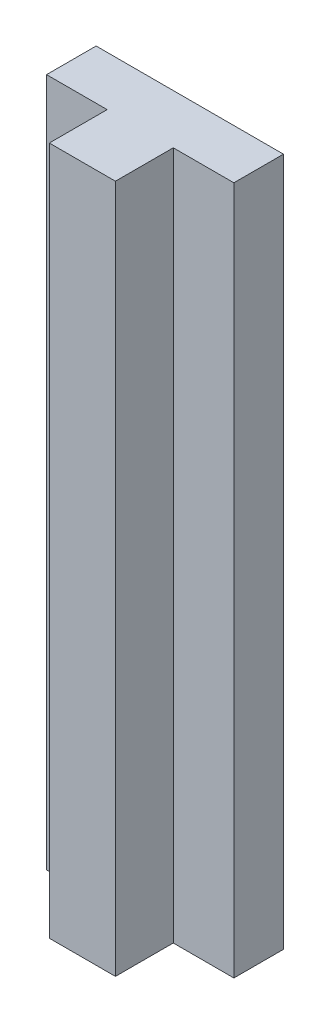
from build123d import *

# Parameters (mm, degrees)
SALIENTE_EXTRUIR1_DEPTH = 50


with BuildPart() as part:
    # Croquis1 → Saliente-Extruir1 (new body)
    with BuildSketch(Plane(origin=(0, 0, 0), x_dir=(1, 0, 0), z_dir=(0, 1, 0))):
        Polygon((-2.4, 0), (-2.4, 4.2), (-6.8, 4.2), (-6.8, 7.8), (0, 7.8), (6.8, 7.8), (6.8, 4.2), (2.4, 4.2), (2.4, 0), align=None)
    extrude(amount=SALIENTE_EXTRUIR1_DEPTH)


solid = part.part
